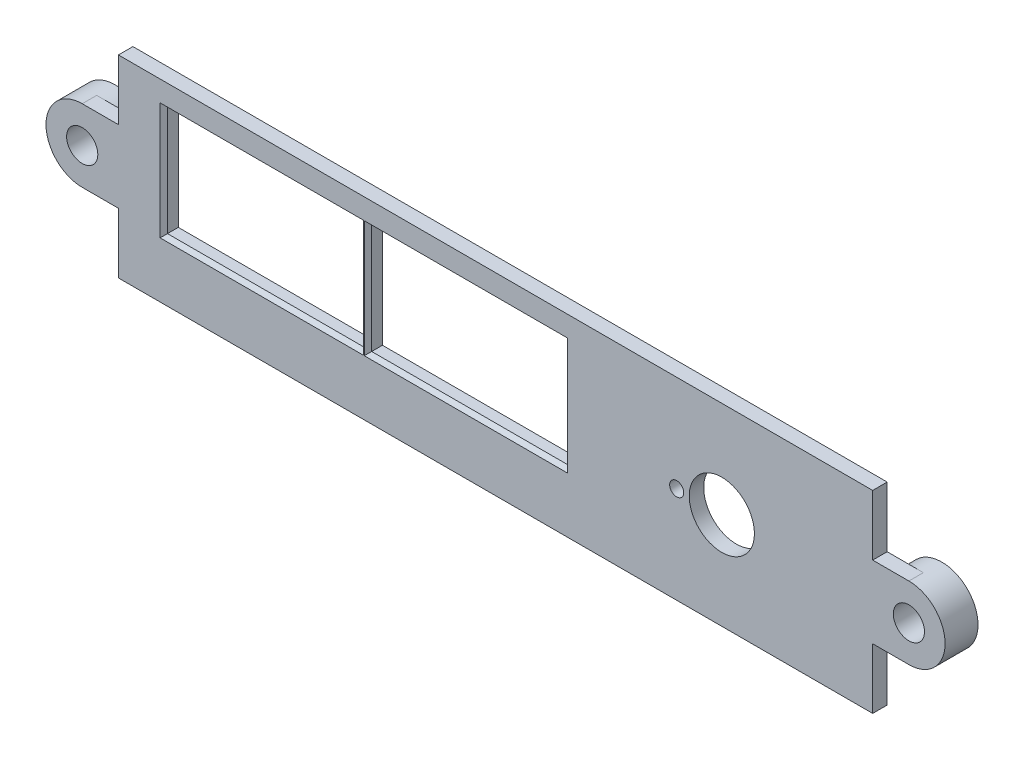
from build123d import *

# Parameters (mm, degrees)
BOSS_EXTRUDE1_DEPTH                    = 2
BOSS_EXTRUDE2_START                    = -2.54
SKETCH5_R                              = 5.00000016
BOSS_EXTRUDE2_DEPTH                    = 2.54
F_18_0_1695_DIAMETER_HOLE1_D           = 4.3053
F_18_0_1695_DIAMETER_HOLE1_DEPTH       = 4.572
F_18_0_1695_DIAMETER_HOLE1_CSINK_D     = 5.08
F_18_0_1695_DIAMETER_HOLE1_CSINK_ANGLE = 90
F_18_0_1695_DIAMETER_HOLE1_TIP         = 1.293442612
SKETCH3_R                              = 4.5
SKETCH3_R_2                            = 0.97241532
SKETCH3_W                              = 27.07
SKETCH3_H                              = 15.132
CUT_EXTRUDE1_DEPTH                     = 64.648399546
CHAMFER1_SIZE                          = 0.508


with BuildPart() as part:
    # Sketch1 → Boss-Extrude1 (new body)
    with BuildSketch(Plane.XY):
        with BuildLine():
            Line((-52.07, 5.00000016), (-57.07000016, 5.00000016))
            ThreePointArc((-57.07000016, 5.00000016), (-62.07000032, 0), (-57.07000016, -5.00000016))
            Line((-57.07000016, -5.00000016), (-52.07, -5.00000016))
            Line((-52.07, -5.00000016), (-52.07, -13.335))
            Line((-52.07, -13.335), (52.07, -13.335))
            Line((52.07, -13.335), (52.07, -5.00000016))
            Line((52.07, -5.00000016), (57.07000016, -5.00000016))
            ThreePointArc((57.07000016, -5.00000016), (62.07000032, 0), (57.07000016, 5.00000016))
            Line((57.07000016, 5.00000016), (52.07, 5.00000016))
            Line((52.07, 5.00000016), (52.07, 13.335))
            Line((52.07, 13.335), (-52.07, 13.335))
            Line((-52.07, 13.335), (-52.07, 5.00000016))
        make_face()
    extrude(amount=BOSS_EXTRUDE1_DEPTH)

    # Sketch5 → Boss-Extrude2 (add)
    with BuildSketch(Plane.XY.offset(BOSS_EXTRUDE2_START)):
        with Locations(Location((-57.07000016, 0, 0), (0, 0, 90))):
            Circle(SKETCH5_R)
        with Locations(Location((57.07000016, 0, 0), (0, 0, 270))):
            Circle(SKETCH5_R)
    extrude(amount=BOSS_EXTRUDE2_DEPTH)

    # #18 (0.1695) Diameter Hole1
    with Locations(Plane(origin=(0, 0, -2.54), x_dir=(-1, 0, 0), z_dir=(0, 0, -1))):
        with Locations((57.07000016, 0), (-57.07000016, 0)):
            CounterSinkHole(F_18_0_1695_DIAMETER_HOLE1_D / 2, F_18_0_1695_DIAMETER_HOLE1_CSINK_D / 2, depth=F_18_0_1695_DIAMETER_HOLE1_DEPTH, counter_sink_angle=F_18_0_1695_DIAMETER_HOLE1_CSINK_ANGLE)
            with Locations((0, 0, -(F_18_0_1695_DIAMETER_HOLE1_DEPTH + F_18_0_1695_DIAMETER_HOLE1_TIP / 2))):  # 118° drill point
                Cone(0, F_18_0_1695_DIAMETER_HOLE1_D / 2, F_18_0_1695_DIAMETER_HOLE1_TIP, mode=Mode.SUBTRACT)

    # Sketch3 → Cut-Extrude1 (cut, through all)
    with BuildSketch(Plane.XY.offset(2)):
        with Locations((31.240005277, 0)):
            Circle(SKETCH3_R)
        with Locations((25.010807092, 0)):
            Circle(SKETCH3_R_2)
        with Locations((-4.079994723, 2.413)):
            Rectangle(SKETCH3_W, SKETCH3_H)
        with Locations((-32.269994731, 2.413)):
            Rectangle(SKETCH3_W, SKETCH3_H)
    extrude(amount=-CUT_EXTRUDE1_DEPTH, mode=Mode.SUBTRACT)

    # Chamfer1
    chamfer1_edges = [part.edges().sort_by_distance(p)[0] for p in [
        (-18.734994731, 2.413, 2),
        (-32.269994731, 9.979, 2),
        (-45.804994731, 2.413, 2),
        (-32.269994731, -5.153, 2),
        (-17.614994723, 2.413, 2),
        (-4.079994723, -5.153, 2),
        (9.455005277, 2.413, 2),
        (-4.079994723, 9.979, 2),
    ]]
    chamfer(chamfer1_edges, length=CHAMFER1_SIZE)


solid = part.part
